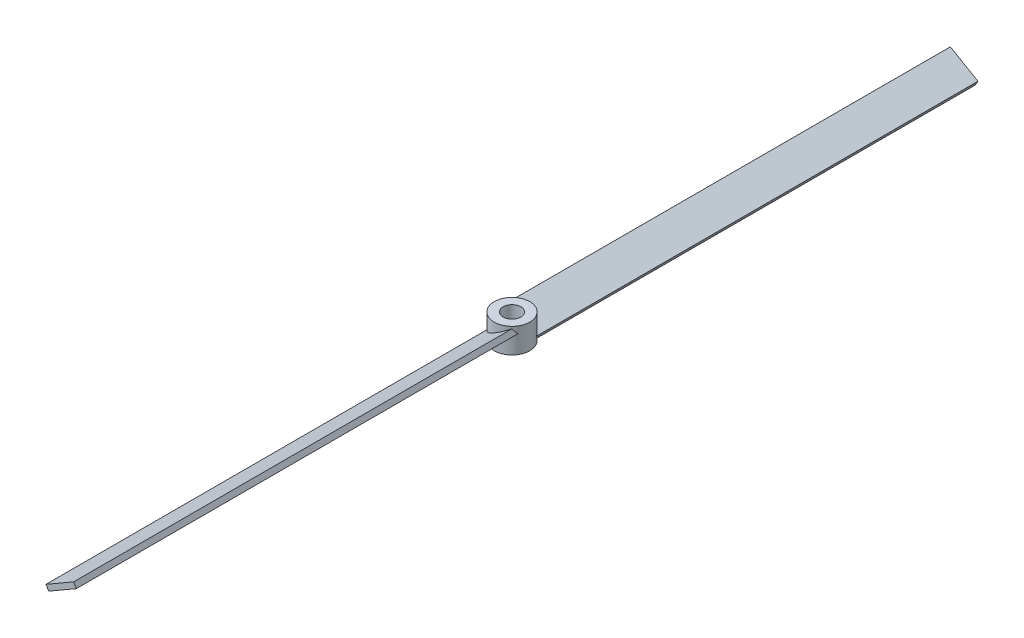
from build123d import *

# Parameters (mm, degrees)
SKETCH_1_R               = 5
EXTRUDE_1_DEPTH          = 7
EXTRUDE_2_DEPTH          = 127
PATTERN_CIRCULAR_1_COUNT = 2
CUT_EXTRUDE_1_REACH      = 129.291
SKETCH_2_R               = 2.5


with BuildPart() as part:
    # 草图1 → 凸台-拉伸1 (new body)
    with BuildSketch(Plane(origin=(0, 0, 0), x_dir=(1, 0, 0), z_dir=(0, 1, 0))):
        with Locations(Location((0, 0, 0), (0, 0, 270))):
            Circle(SKETCH_1_R)
    extrude(amount=EXTRUDE_1_DEPTH)

    # 草图3 → 凸台-拉伸2 (add)
    with BuildSketch(Plane.XY):
        Polygon((-4.272114317, 1.899519053), (3.522114317, 6.399519053), (4.272114317, 5.100480947), (-3.522114317, 0.600480947), align=None)
    extrude_2 = extrude(amount=EXTRUDE_2_DEPTH)

    # 阵列(圆周)1: 凸台-拉伸2 ×2 about axis
    pattern_circular_1_axis = Axis((0, 0, 0), (0, 1, 0))
    for i in range(1, PATTERN_CIRCULAR_1_COUNT):
        add(extrude_2.rotate(pattern_circular_1_axis, i * 360 / PATTERN_CIRCULAR_1_COUNT))

    # 草图2 → 切除-拉伸1 (cut, up to next)
    with BuildSketch(Plane(origin=(0, 7, 0), x_dir=(1, 0, 0), z_dir=(0, 1, 0)), mode=Mode.PRIVATE) as cut_extrude_1_sk1:
        with Locations(Location((0, 0, 0), (0, 0, 270))):
            Circle(SKETCH_2_R)
    cut_extrude_1_tool1 = extrude(cut_extrude_1_sk1.sketch, amount=-CUT_EXTRUDE_1_REACH, mode=Mode.PRIVATE) & part.part
    add(cut_extrude_1_tool1.solids().sort_by_distance((0, 7, 0))[0], mode=Mode.SUBTRACT)


solid = part.part
